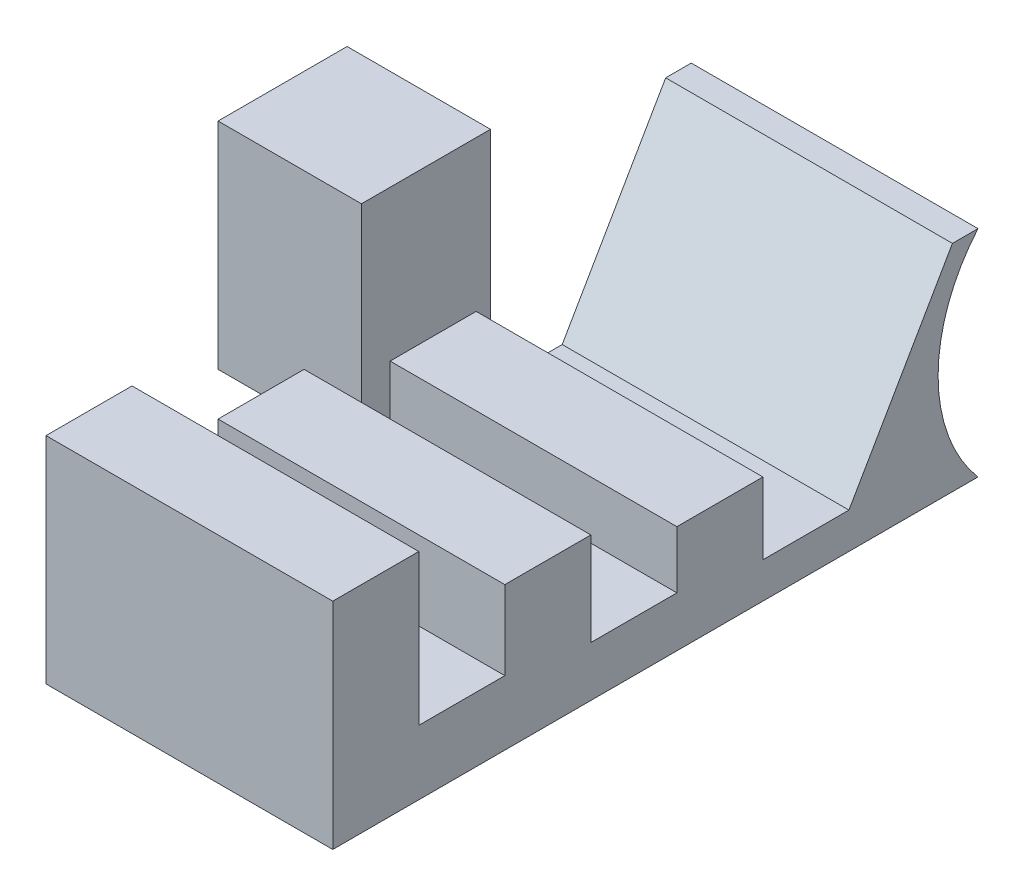
from build123d import *

# Parameters (mm, degrees)
BOSS_EXTRUDE1_DEPTH = 100
SKETCH2_W           = 100
SKETCH2_H           = 90
BOSS_EXTRUDE2_DEPTH = 150


with BuildPart() as part:
    # Sketch1 → Boss-Extrude1 (new, symmetric)
    with BuildSketch(Plane(origin=(0, 0, 0), x_dir=(0, 0, -1), z_dir=(1, 0, 0))):
        with BuildLine():
            Line((0, 0), (0, 150))
            Line((0, 150), (60, 150))
            Line((60, 150), (60, 45))
            Line((60, 45), (120, 45))
            Line((120, 45), (120, 100))
            Line((120, 100), (180, 100))
            Line((180, 100), (180, 35))
            Line((180, 35), (240, 35))
            Line((240, 35), (240, 75))
            Line((240, 75), (300, 75))
            Line((300, 75), (300, 25))
            Line((300, 25), (360, 25))
            Line((360, 25), (432.168783649, 150))
            Line((432.168783649, 150), (450, 150))
            ThreePointArc((450, 150), (422.177978871, 75), (450, 0))
            Line((450, 0), (0, 0))
        make_face()
    extrude(amount=BOSS_EXTRUDE1_DEPTH, both=True)


with BuildPart() as body_2:
    # Sketch2 → Boss-Extrude2 (new body)
    with BuildSketch(Plane.XZ):
        with Locations((-180, -295)):
            Rectangle(SKETCH2_W, SKETCH2_H)
    extrude(amount=-BOSS_EXTRUDE2_DEPTH)


solid = Compound([part.part, body_2.part])
